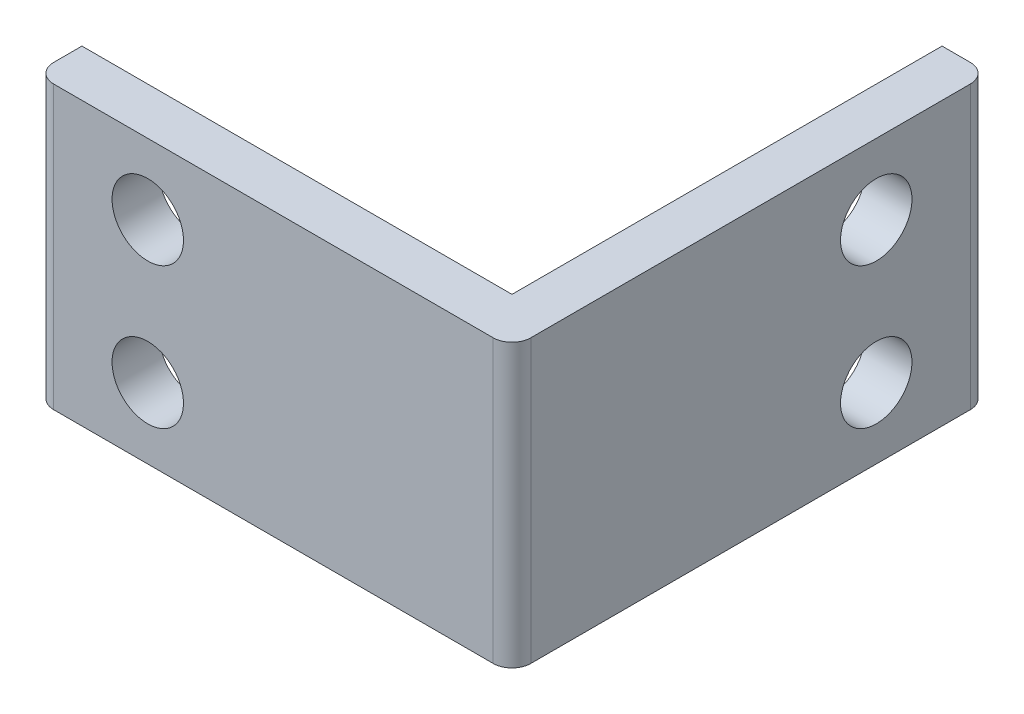
from build123d import *

# Parameters (mm, degrees)
SKETCH1_W           = 64.4398
SKETCH1_H           = 38.1
BOSS_EXTRUDE1_DEPTH = 6.35
SKETCH2_W           = 64.4398
SKETCH2_H           = 38.1
BOSS_EXTRUDE2_DEPTH = 6.35
SKETCH3_R           = 4.826
CUT_EXTRUDE1_DEPTH  = 99.775430387
SKETCH4_R           = 4.826
CUT_EXTRUDE4_DEPTH  = 99.775430387
FILLET1_R           = 2.54
FILLET2_R           = 2.54
FILLET3_R           = 2.54


with BuildPart() as part:
    # Sketch1 → Boss-Extrude1 (new body)
    with BuildSketch(Plane.XY):
        with Locations((32.2199, 19.05)):
            Rectangle(SKETCH1_W, SKETCH1_H)
    extrude(amount=-BOSS_EXTRUDE1_DEPTH)

    # Sketch2 → Boss-Extrude2 (add)
    with BuildSketch(Plane(origin=(64.4398, 0, 0), x_dir=(0, 0, -1), z_dir=(1, 0, 0))):
        with Locations((32.2199, 19.05)):
            Rectangle(SKETCH2_W, SKETCH2_H)
    extrude(amount=-BOSS_EXTRUDE2_DEPTH)

    # Sketch3 → Cut-Extrude1 (cut, through all)
    with BuildSketch(Plane(origin=(64.4398, 0, 0), x_dir=(0, 0, -1), z_dir=(1, 0, 0))):
        with Locations((49.1998, 28.575)):
            Circle(SKETCH3_R)
        with Locations(Location((49.1998, 9.525, 0), (0, 0, 180))):
            Circle(SKETCH3_R)
    extrude(amount=-CUT_EXTRUDE1_DEPTH, mode=Mode.SUBTRACT)

    # Sketch4 → Cut-Extrude4 (cut, through all)
    with BuildSketch(Plane.XY):
        with Locations((15.24, 28.575)):
            Circle(SKETCH4_R)
        with Locations(Location((15.24, 9.525, 0), (0, 0, 180))):
            Circle(SKETCH4_R)
    extrude(amount=-CUT_EXTRUDE4_DEPTH, mode=Mode.SUBTRACT)

    # Fillet1
    fillet1_edges = [part.edges().sort_by_distance(p)[0] for p in [
        (0, 19.05, 0),
    ]]
    fillet(fillet1_edges, radius=FILLET1_R)

    # Fillet2
    fillet2_edges = [part.edges().sort_by_distance(p)[0] for p in [
        (64.4398, 19.05, -64.4398),
    ]]
    fillet(fillet2_edges, radius=FILLET2_R)

    # Fillet3
    fillet3_edges = [part.edges().sort_by_distance(p)[0] for p in [
        (64.4398, 19.05, 0),
    ]]
    fillet(fillet3_edges, radius=FILLET3_R)


solid = part.part
